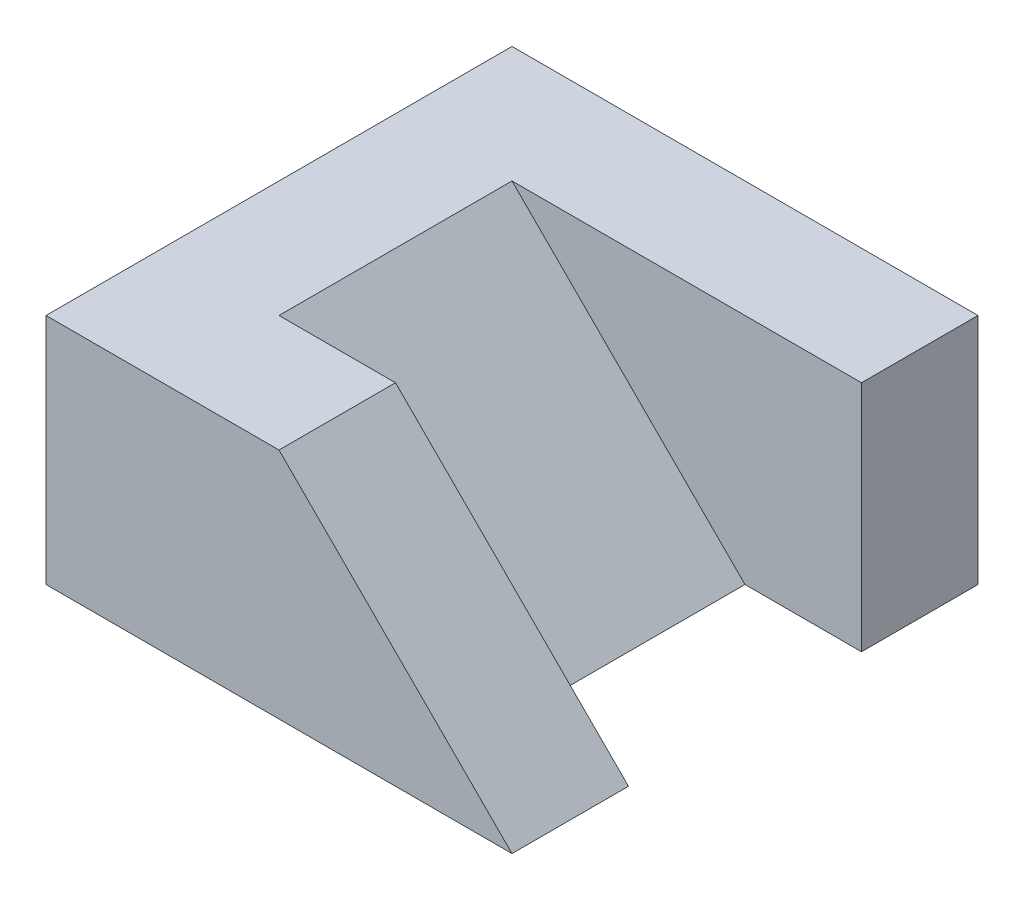
from build123d import *

# Parameters (mm, degrees)
EXTRUDE_1_DEPTH     = 20
EXTRUDE_2_DEPTH     = 20
CUT_EXTRUDE_1_DEPTH = 20


with BuildPart() as part:
    # 草圖1 → 填料-伸長1 (new body)
    with BuildSketch(Plane(origin=(0, 0, 0), x_dir=(1, 0, 0), z_dir=(0, 1, 0))):
        Polygon((0, 0), (40, 0), (40, -10), (10, -10), (10, -30), (40, -30), (40, -40), (0, -40), align=None)
    extrude(amount=EXTRUDE_1_DEPTH)

    # 草圖2 → 填料-伸長2 (add)
    with BuildSketch(Plane.XY.offset(10)):
        Polygon((10, 20), (30, 0), (10, 0), align=None)
    extrude(amount=EXTRUDE_2_DEPTH)

    # 草圖3 → 除料-伸長1 (cut)
    with BuildSketch(Plane.XY.offset(40)):
        Polygon((20, 20), (40, 0), (40, 20), align=None)
    extrude(amount=-CUT_EXTRUDE_1_DEPTH, mode=Mode.SUBTRACT)


solid = part.part
